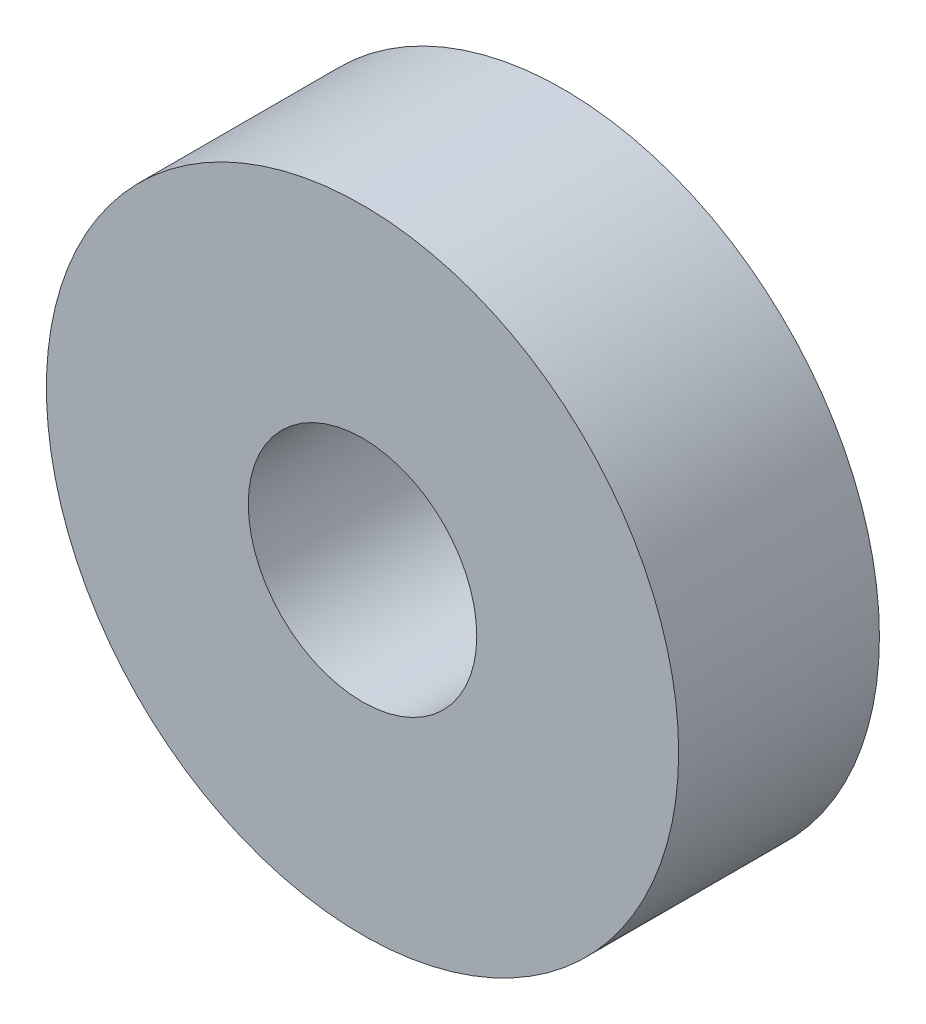
from build123d import *

# Parameters (mm, degrees)
SKETCH1_R           = 10.9982
SKETCH1_R_2         = 3.9751
BOSS_EXTRUDE1_DEPTH = 6.985


with BuildPart() as part:
    # Sketch1 → Boss-Extrude1 (new body)
    with BuildSketch(Plane.XY):
        Circle(SKETCH1_R)
        Circle(SKETCH1_R_2, mode=Mode.SUBTRACT)
    extrude(amount=BOSS_EXTRUDE1_DEPTH)


solid = part.part
